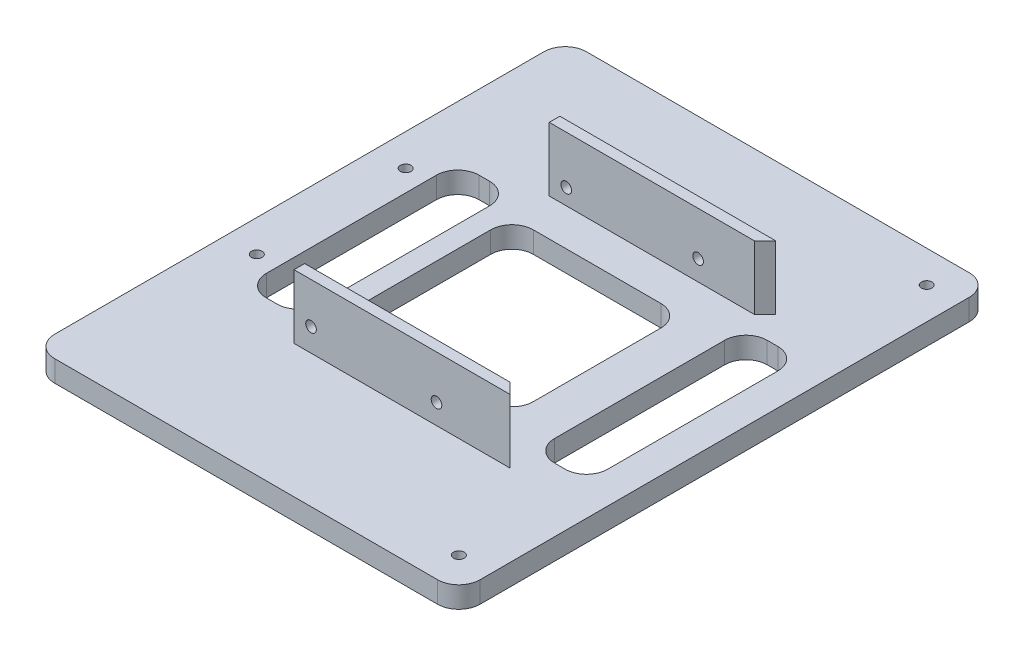
from build123d import *

# Parameters (mm, degrees)
RESSALTO_EXTRUS_O1_DEPTH = 10
ESBO_O2_R                = 2.5
CORTE_EXTRUS_O1_DEPTH    = 218.763914705
RESSALTO_EXTRUS_O2_DEPTH = 30
ESBO_O5_R                = 2.5
CORTE_EXTRUS_O2_DEPTH    = 5
ESBO_O6_R                = 2.5
CORTE_EXTRUS_O3_DEPTH    = 5
CORTE_EXTRUS_O4_DEPTH    = 10


with BuildPart() as part:
    # Esboço1 → Ressalto-extrusão1 (new body)
    with BuildSketch(Plane(origin=(0, 0, 0), x_dir=(1, 0, 0), z_dir=(0, 1, 0))):
        with BuildLine():
            Line((-88.275862069, -57.715517241), (91.724137931, -57.715517241))
            ThreePointArc((91.724137931, -57.715517241), (98.795205743, -54.786585053), (101.724137931, -47.715517241))
            Line((101.724137931, -47.715517241), (101.724137931, 182.284482759))
            ThreePointArc((101.724137931, 182.284482759), (98.795205743, 189.35555057), (91.724137931, 192.284482759))
            Line((91.724137931, 192.284482759), (-88.275862069, 192.284482759))
            ThreePointArc((-88.275862069, 192.284482759), (-95.346929881, 189.35555057), (-98.275862069, 182.284482759))
            Line((-98.275862069, 182.284482759), (-98.275862069, -47.715517241))
            ThreePointArc((-98.275862069, -47.715517241), (-95.346929881, -54.786585053), (-88.275862069, -57.715517241))
        make_face()
    extrude(amount=RESSALTO_EXTRUS_O1_DEPTH)

    # Esboço2 → Corte-extrusão1 (cut, through all)
    with BuildSketch(Plane(origin=(0, 10, 0), x_dir=(1, 0, 0), z_dir=(0, 1, 0))):
        with Locations(Location((-83.275862069, 102.284482759, 0), (0, 0, 270))):
            Circle(ESBO_O2_R)
        with Locations(Location((86.724137931, 177.284482759, 0), (0, 0, 90))):
            Circle(ESBO_O2_R)
        with Locations(Location((86.724137931, -42.715517241, 0), (0, 0, 270))):
            Circle(ESBO_O2_R)
        with Locations(Location((-83.275862069, 32.284482759, 0), (0, 0, 90))):
            Circle(ESBO_O2_R)
        with BuildLine():
            Line((31.724137931, 107.284482759), (-28.275862069, 107.284482759))
            ThreePointArc((-28.275862069, 107.284482759), (-35.346929881, 104.35555057), (-38.275862069, 97.284482759))
            Line((-38.275862069, 97.284482759), (-38.275862069, 37.284482759))
            ThreePointArc((-38.275862069, 37.284482759), (-35.346929881, 30.213414947), (-28.275862069, 27.284482759))
            Line((-28.275862069, 27.284482759), (31.724137931, 27.284482759))
            ThreePointArc((31.724137931, 27.284482759), (38.795205743, 30.213414947), (41.724137931, 37.284482759))
            Line((41.724137931, 37.284482759), (41.724137931, 97.284482759))
            ThreePointArc((41.724137931, 97.284482759), (38.795205743, 104.35555057), (31.724137931, 107.284482759))
        make_face()
    extrude(amount=-CORTE_EXTRUS_O1_DEPTH, mode=Mode.SUBTRACT)

    # Esboço4 → Ressalto-extrusão2 (add)
    with BuildSketch(Plane(origin=(0, 10, 0), x_dir=(1, 0, 0), z_dir=(0, 1, 0))):
        Polygon((58.224137931, 9.784482759), (-38.275862069, 9.784482759), (-38.275862069, 4.784482759), (63.224137931, 4.784482759), align=None)
        Polygon((58.224137931, 124.784482759), (-38.275862069, 124.784482759), (-38.275862069, 129.784482759), (63.224137931, 129.784482759), align=None)
    extrude(amount=RESSALTO_EXTRUS_O2_DEPTH)

    # Esboço5 → Corte-extrusão2 (cut)
    with BuildSketch(Plane.XY.offset(-4.784482759)):
        with Locations((-30.275862069, 20.836178243)):
            Circle(ESBO_O5_R)
        with Locations((28.724137931, 19.5)):
            Circle(ESBO_O5_R)
    extrude(amount=-CORTE_EXTRUS_O2_DEPTH, mode=Mode.SUBTRACT)

    # Esboço6 → Corte-extrusão3 (cut)
    with BuildSketch(Plane(origin=(0, 0, -129.784482759), x_dir=(-1, 0, 0), z_dir=(0, 0, -1))):
        with Locations((-31.724137931, 19.5)):
            Circle(ESBO_O6_R)
        with Locations((30.275862069, 17.5)):
            Circle(ESBO_O6_R)
    extrude(amount=-CORTE_EXTRUS_O3_DEPTH, mode=Mode.SUBTRACT)

    # Esboço7 → Corte-extrusão4 (cut)
    with BuildSketch(Plane(origin=(0, 10, 0), x_dir=(1, 0, 0), z_dir=(0, 1, 0))):
        with BuildLine():
            Line((76.724137931, 117.284482759), (71.724137931, 117.284482759))
            ThreePointArc((71.724137931, 117.284482759), (64.653070119, 114.35555057), (61.724137931, 107.284482759))
            Line((61.724137931, 107.284482759), (61.724137931, 27.284482759))
            ThreePointArc((61.724137931, 27.284482759), (64.653070119, 20.213414947), (71.724137931, 17.284482759))
            Line((71.724137931, 17.284482759), (76.724137931, 17.284482759))
            ThreePointArc((76.724137931, 17.284482759), (83.795205743, 20.213414947), (86.724137931, 27.284482759))
            Line((86.724137931, 27.284482759), (86.724137931, 107.284482759))
            ThreePointArc((86.724137931, 107.284482759), (83.795205743, 114.35555057), (76.724137931, 117.284482759))
        make_face()
        with BuildLine():
            Line((-58.289420658, 116.784482759), (-63.289420658, 116.784482759))
            ThreePointArc((-63.289420658, 116.784482759), (-70.36048847, 113.85555057), (-73.289420658, 106.784482759))
            Line((-73.289420658, 106.784482759), (-73.289420658, 26.784482759))
            ThreePointArc((-73.289420658, 26.784482759), (-70.36048847, 19.713414947), (-63.289420658, 16.784482759))
            Line((-63.289420658, 16.784482759), (-58.289420658, 16.784482759))
            ThreePointArc((-58.289420658, 16.784482759), (-51.218352846, 19.713414947), (-48.289420658, 26.784482759))
            Line((-48.289420658, 26.784482759), (-48.289420658, 106.784482759))
            ThreePointArc((-48.289420658, 106.784482759), (-51.218352846, 113.85555057), (-58.289420658, 116.784482759))
        make_face()
    extrude(amount=-CORTE_EXTRUS_O4_DEPTH, mode=Mode.SUBTRACT)


solid = part.part
